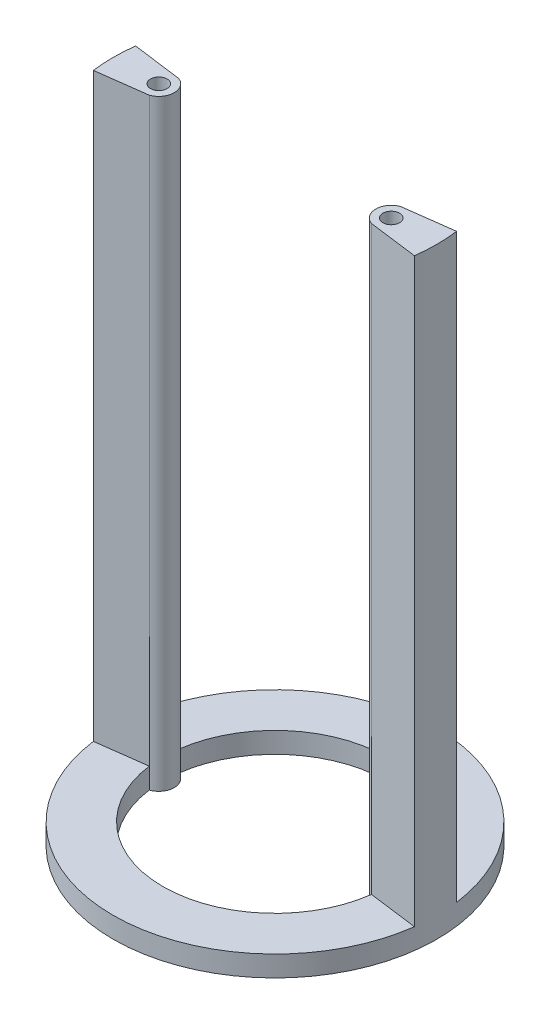
from build123d import *
from build123d.topology import SkipClean

# Parameters (mm, degrees)
SKETCH1_R           = 49.53
SKETCH1_R_2         = 34.29
BOSS_EXTRUDE1_DEPTH = 6.35
SKETCH2_R           = 2.5527
BOSS_EXTRUDE2_DEPTH = 177.8
SKETCH5_R           = 2.5527
CUT_EXTRUDE1_DEPTH  = 6.35
BOSS_EXTRUDE3_START = -6.35
SKETCH2_3_R         = 2.5527
BOSS_EXTRUDE3_DEPTH = 6.35


with BuildPart() as part:
    # Sketch1 → Boss-Extrude1 (new body)
    with BuildSketch(Plane(origin=(0, 0, 0), x_dir=(1, 0, 0), z_dir=(0, 1, 0))):
        Circle(SKETCH1_R)
        Circle(SKETCH1_R_2, mode=Mode.SUBTRACT)
    extrude(amount=BOSS_EXTRUDE1_DEPTH)

    # Sketch2 → Boss-Extrude2 (add)
    # profile 1 of 2: a face of its own
    with SkipClean():  # the faces are left unmerged after this step: merging them gives an invalid solid
        with BuildSketch(Plane(origin=(0, 6.35, 0), x_dir=(1, 0, 0), z_dir=(0, 1, 0))):
            with BuildLine():
                Line((-49.106264, 6.464962), (-33.996644, 4.475743))
                ThreePointArc((-33.996644, 4.475743), (-30.819076, 0), (-33.996644, -4.475743))
                Line((-33.996644, -4.475743), (-49.106264, -6.464962))
                ThreePointArc((-49.106264, -6.464962), (-49.53, 0), (-49.106264, 6.464962))
            make_face()
            with Locations((-35.56, 0)):
                Circle(SKETCH2_R, mode=Mode.SUBTRACT)
        # profile 2 of 2: a face of its own
        with BuildSketch(Plane(origin=(0, 6.35, 0), x_dir=(1, 0, 0), z_dir=(0, 1, 0))):
            with BuildLine():
                Line((33.996644, 4.475743), (49.106264, 6.464962))
                ThreePointArc((49.106264, 6.464962), (49.53, 0), (49.106264, -6.464962))
                Line((49.106264, -6.464962), (33.996644, -4.475743))
                ThreePointArc((33.996644, -4.475743), (30.819076, 0), (33.996644, 4.475743))
            make_face()
            with Locations((35.56, 0)):
                Circle(SKETCH2_R, mode=Mode.SUBTRACT)
        extrude(amount=BOSS_EXTRUDE2_DEPTH)

    # Sketch5 → Cut-Extrude1 (cut)
    with SkipClean():  # the faces are left unmerged after this step: merging them gives an invalid solid
        with BuildSketch(Plane.XZ):
            with Locations((-35.56, 0)):
                Circle(SKETCH5_R)
            with Locations((35.56, 0)):
                Circle(SKETCH5_R)
        extrude(amount=-CUT_EXTRUDE1_DEPTH, mode=Mode.SUBTRACT)

    # Sketch2<3> → Boss-Extrude3 (add)
    # profile 1 of 2: a face of its own
    with BuildSketch(Plane(origin=(0, 6.35, 0), x_dir=(1, 0, 0), z_dir=(0, 1, 0)).offset(BOSS_EXTRUDE3_START)):
        with BuildLine():
            Line((-49.106264, 6.464962), (-33.996644, 4.475743))
            ThreePointArc((-33.996644, 4.475743), (-30.819076, 0), (-33.996644, -4.475743))
            Line((-33.996644, -4.475743), (-49.106264, -6.464962))
            ThreePointArc((-49.106264, -6.464962), (-49.53, 0), (-49.106264, 6.464962))
        make_face()
        with Locations((-35.56, 0)):
            Circle(SKETCH2_3_R, mode=Mode.SUBTRACT)
    # profile 2 of 2: a face of its own
    with BuildSketch(Plane(origin=(0, 6.35, 0), x_dir=(1, 0, 0), z_dir=(0, 1, 0)).offset(BOSS_EXTRUDE3_START)):
        with BuildLine():
            Line((33.996644, 4.475743), (49.106264, 6.464962))
            ThreePointArc((49.106264, 6.464962), (49.53, 0), (49.106264, -6.464962))
            Line((49.106264, -6.464962), (33.996644, -4.475743))
            ThreePointArc((33.996644, -4.475743), (30.819076, 0), (33.996644, 4.475743))
        make_face()
        with Locations((35.56, 0)):
            Circle(SKETCH2_3_R, mode=Mode.SUBTRACT)
    extrude(amount=BOSS_EXTRUDE3_DEPTH)


solid = part.part
